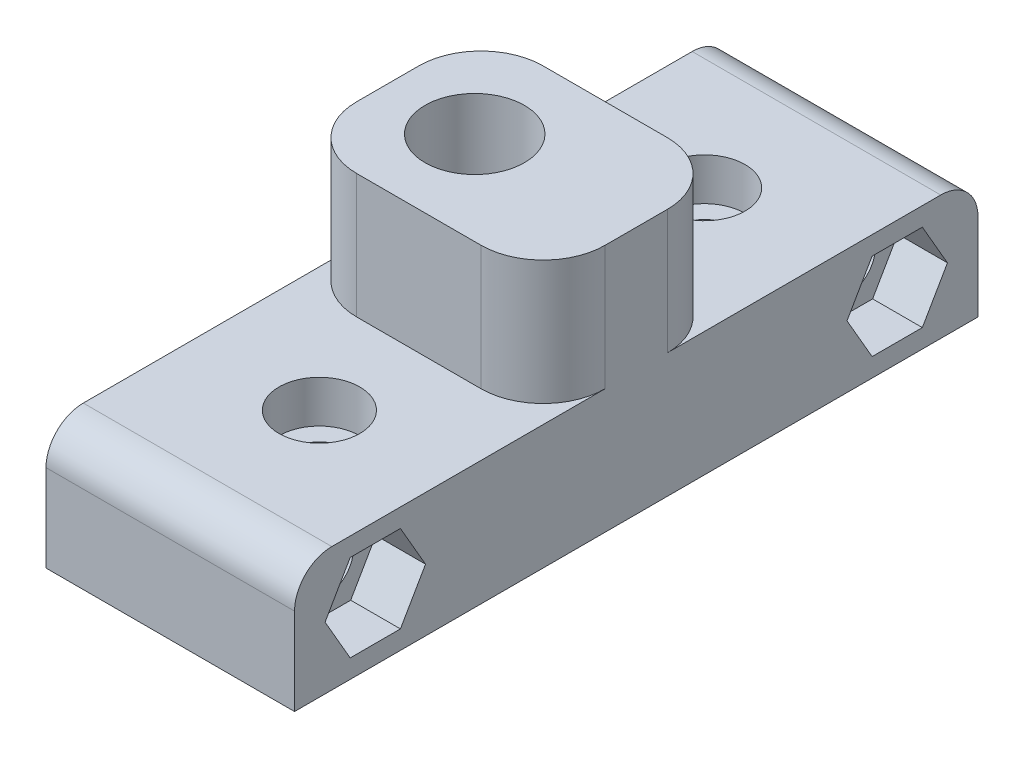
from build123d import *

# Parameters (mm, degrees)
SKETCH1_W                                           = 20
SKETCH1_H                                           = 55
BOSS_EXTRUDE1_DEPTH                                 = 20
SKETCH2_R                                           = 4
CUT_EXTRUDE1_DEPTH                                  = 10
SKETCH3_W                                           = 20
SKETCH3_H                                           = 20
CUT_EXTRUDE2_DEPTH                                  = 10
CBORE_FOR_M3_HEX_SOCKET_HEAD_CAP_SCREW1_D           = 3.4
CBORE_FOR_M3_HEX_SOCKET_HEAD_CAP_SCREW1_CBORE_D     = 6.5
CBORE_FOR_M3_HEX_SOCKET_HEAD_CAP_SCREW1_CBORE_DEPTH = 3.4
FILLET2_R                                           = 5
SKETCH9_R                                           = 2.25
CUT_EXTRUDE5_DEPTH                                  = 40.449334595
CUT_EXTRUDE6_DEPTH                                  = 4
FILLET5_R                                           = 3


with BuildPart() as part:
    # Sketch1 → Boss-Extrude1 (new body)
    with BuildSketch(Plane(origin=(0, 0, 0), x_dir=(1, 0, 0), z_dir=(0, 1, 0))):
        Rectangle(SKETCH1_W, SKETCH1_H)
    extrude(amount=BOSS_EXTRUDE1_DEPTH)

    # Sketch2 → Cut-Extrude1 (cut)
    with BuildSketch(Plane(origin=(0, 20, 0), x_dir=(1, 0, 0), z_dir=(0, 1, 0))):
        with Locations(Location((-3, 0, 0), (0, 0, 270))):
            Circle(SKETCH2_R)
    extrude(amount=-CUT_EXTRUDE1_DEPTH, mode=Mode.SUBTRACT)

    # Sketch3 → Cut-Extrude2 (cut)
    with BuildSketch(Plane(origin=(0, 20, 0), x_dir=(1, 0, 0), z_dir=(0, 1, 0))):
        with Locations((0, -17.5)):
            Rectangle(SKETCH3_W, SKETCH3_H)
        with Locations((0, 17.5)):
            Rectangle(SKETCH3_W, SKETCH3_H)
    extrude(amount=-CUT_EXTRUDE2_DEPTH, mode=Mode.SUBTRACT)

    # CBORE for M3 Hex Socket Head Cap Screw1 (through all)
    with Locations(Plane(origin=(0, 10, 0), x_dir=(1, 0, 0), z_dir=(0, 1, 0))):
        with Locations((0, -15.5), (0, 15.5)):
            CounterBoreHole(CBORE_FOR_M3_HEX_SOCKET_HEAD_CAP_SCREW1_D / 2, CBORE_FOR_M3_HEX_SOCKET_HEAD_CAP_SCREW1_CBORE_D / 2, CBORE_FOR_M3_HEX_SOCKET_HEAD_CAP_SCREW1_CBORE_DEPTH)

    # Fillet2
    fillet2_edges = [part.edges().sort_by_distance(p)[0] for p in [
        (-10, 15, 7.5),
        (10, 15, 7.5),
        (-10, 15, -7.5),
        (10, 15, -7.5),
    ]]
    fillet(fillet2_edges, radius=FILLET2_R)

    # Sketch9 → Cut-Extrude5 (cut, through all)
    with BuildSketch(Plane.ZY.offset(10)):
        with Locations((-21, 5)):
            Circle(SKETCH9_R)
        with Locations((21, 5)):
            Circle(SKETCH9_R)
    extrude(amount=-CUT_EXTRUDE5_DEPTH, mode=Mode.SUBTRACT)

    # Sketch10 → Cut-Extrude6 (cut)
    with BuildSketch(Plane(origin=(10, 0, 0), x_dir=(0, 0, -1), z_dir=(1, 0, 0))):
        Polygon((-16.958548116, 5), (-18.979274058, 8.5), (-23.020725942, 8.5), (-25.041451884, 5), (-23.020725942, 1.5), (-18.979274058, 1.5), align=None)
        Polygon((16.958548116, 5), (18.979274058, 1.5), (23.020725942, 1.5), (25.041451884, 5), (23.020725942, 8.5), (18.979274058, 8.5), align=None)
    extrude(amount=-CUT_EXTRUDE6_DEPTH, mode=Mode.SUBTRACT)

    # Fillet5
    fillet5_edges = [part.edges().sort_by_distance(p)[0] for p in [
        (0, 10, 27.5),
        (0, 10, -27.5),
    ]]
    fillet(fillet5_edges, radius=FILLET5_R)


solid = part.part
